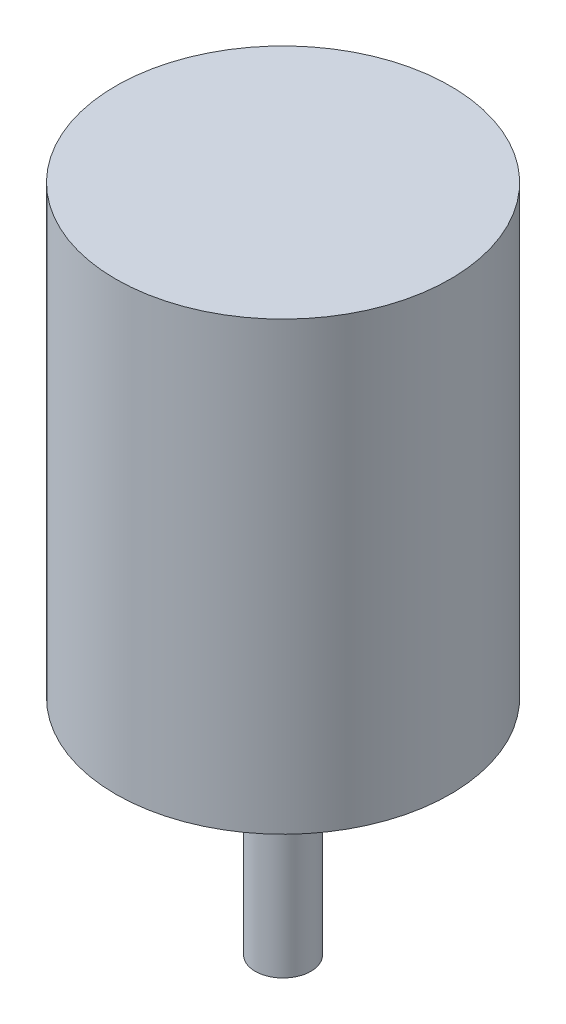
from build123d import *

# Parameters (mm, degrees)
SKETCH1_R           = 2.5
BOSS_EXTRUDE1_DEPTH = 20
SKETCH2_R           = 15
BOSS_EXTRUDE2_DEPTH = 40


with BuildPart() as part:
    # Sketch1 → Boss-Extrude1 (new body)
    with BuildSketch(Plane(origin=(0, 0, 0), x_dir=(1, 0, 0), z_dir=(0, 1, 0))):
        with Locations(Location((0, 0, 0), (0, 0, 270))):
            Circle(SKETCH1_R)
    extrude(amount=BOSS_EXTRUDE1_DEPTH)

    # Sketch2 → Boss-Extrude2 (add)
    with BuildSketch(Plane(origin=(0, 20, 0), x_dir=(1, 0, 0), z_dir=(0, 1, 0))):
        with Locations(Location((0, 0, 0), (0, 0, 270))):
            Circle(SKETCH2_R)
    extrude(amount=BOSS_EXTRUDE2_DEPTH)


solid = part.part
